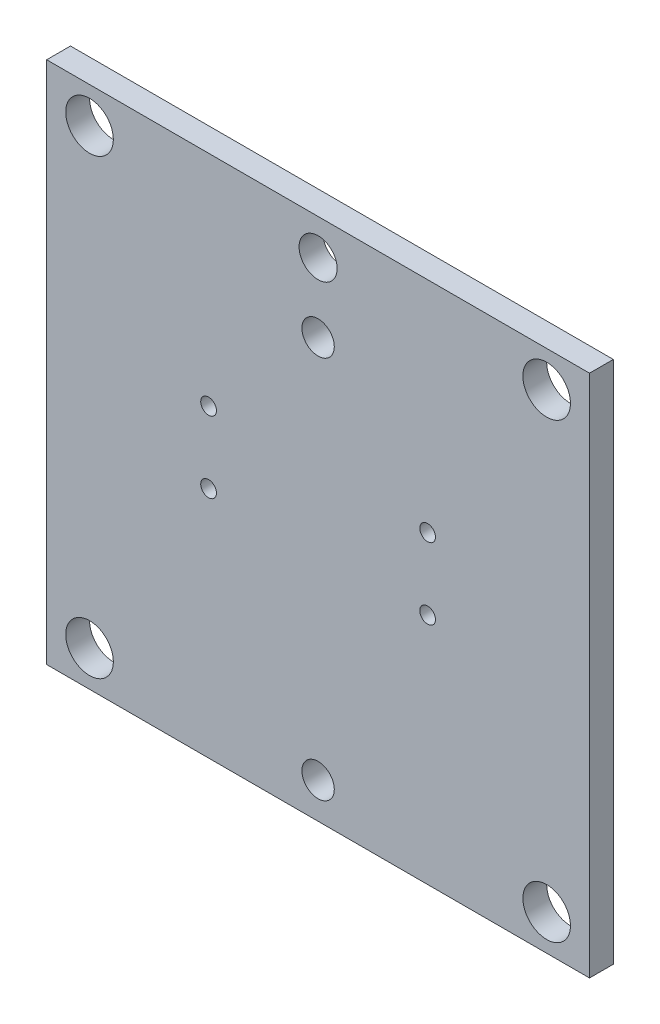
from build123d import *

# Parameters (mm, degrees)
SKETCH_1_W               = 114
SKETCH_1_H               = 110
EXTRUDE_2_DEPTH          = 2.5
SKETCH_2_R               = 5
CUT_EXTRUDE_1_DEPTH      = 80.366239674
MIRROR_2_COPY_1_SKETCH_R = 5
MIRROR_2_COPY_1_DEPTH    = 80.366239674
HOLE_WIZARD_M4_1_D       = 3.3
HOLE_WIZARD_M8_3_D       = 6.8
SKETCH_8_R               = 4
CUT_EXTRUDE_2_DEPTH      = 80.366239674
HOLE_WIZARD_M8_4_D       = 6.8


with BuildPart() as part:
    # 草图1 → 凸台-拉伸2 (new, symmetric)
    with BuildSketch(Plane.XY):
        Rectangle(SKETCH_1_W, SKETCH_1_H)
    extrude(amount=EXTRUDE_2_DEPTH, both=True)

    # 草图2 → 切除-拉伸1 (cut, through all)
    with BuildSketch(Plane.XY.offset(2.5)):
        with Locations((-48, 47.5)):
            Circle(SKETCH_2_R)
    cut_extrude_1 = extrude(amount=-CUT_EXTRUDE_1_DEPTH, mode=Mode.SUBTRACT)

    # 镜向1: 切除-拉伸1 across plane
    add(cut_extrude_1.mirror(Plane.ZX), mode=Mode.SUBTRACT)

    # 镜向2: 切除-拉伸1 across plane
    add(cut_extrude_1.mirror(Plane(origin=(0, 0, 0), x_dir=(0, 0, 1), z_dir=(1, 0, 0))), mode=Mode.SUBTRACT)

    # 镜向2 copy 1 sketch → 镜向2 copy 1 (cut, through all)
    with BuildSketch(Plane(origin=(0, 0, 2.5), x_dir=(-1, 0, 0), z_dir=(0, 0, 1))):
        with Locations((-48, 47.5)):
            Circle(MIRROR_2_COPY_1_SKETCH_R)
    extrude(amount=-MIRROR_2_COPY_1_DEPTH, mode=Mode.SUBTRACT)

    # M4 螺纹孔的螺纹孔钻头1 (through all)
    with Locations(Plane(origin=(-23, 9, 2.5), x_dir=(1, 0, 0), z_dir=(0, 0, 1))):
        with Locations((0, 0), (0, -15)):
            hole_wizard_m4_1 = Hole(HOLE_WIZARD_M4_1_D / 2)

    # 镜向4: M4 螺纹孔的螺纹孔钻头1 across plane
    add(hole_wizard_m4_1.mirror(Plane(origin=(0, 0, 0), x_dir=(0, 0, 1), z_dir=(1, 0, 0))), mode=Mode.SUBTRACT)

    # M8 螺纹孔的螺纹孔钻头3 (through all)
    with Locations(Plane(origin=(0, 33, 2.5), x_dir=(1, 0, 0), z_dir=(0, 0, 1))):
        with Locations((0, 0)):
            Hole(HOLE_WIZARD_M8_3_D / 2)

    # 草图8 → 切除-拉伸2 (cut, through all)
    with BuildSketch(Plane.XY.offset(2.5)):
        with Locations((0, 47.5)):
            Circle(SKETCH_8_R)
    extrude(amount=-CUT_EXTRUDE_2_DEPTH, mode=Mode.SUBTRACT)

    # M8 螺纹孔的螺纹孔钻头4 (through all)
    with Locations(Plane(origin=(0, -47.5, 2.5), x_dir=(1, 0, 0), z_dir=(0, 0, 1))):
        with Locations((0, 0)):
            Hole(HOLE_WIZARD_M8_4_D / 2)


solid = part.part
